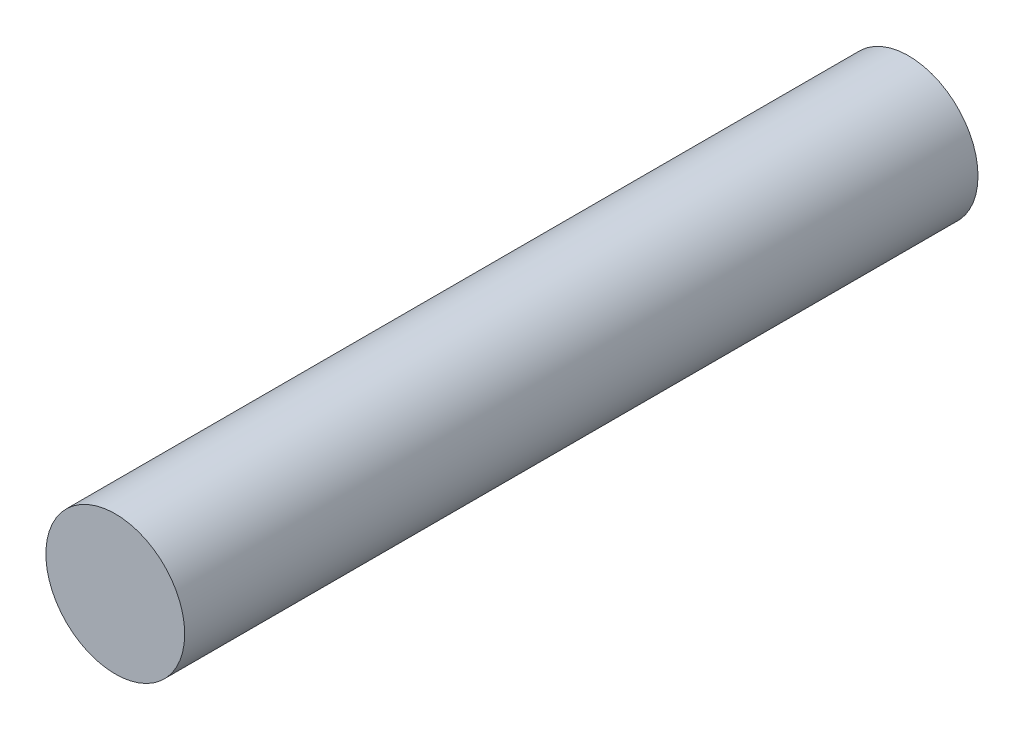
from build123d import *

# Parameters (mm, degrees)
SKETCH1_R           = 35
BOSS_EXTRUDE1_DEPTH = 400


with BuildPart() as part:
    # Sketch1 → Boss-Extrude1 (new body)
    with BuildSketch(Plane.XY):
        Circle(SKETCH1_R)
    extrude(amount=BOSS_EXTRUDE1_DEPTH)


solid = part.part
